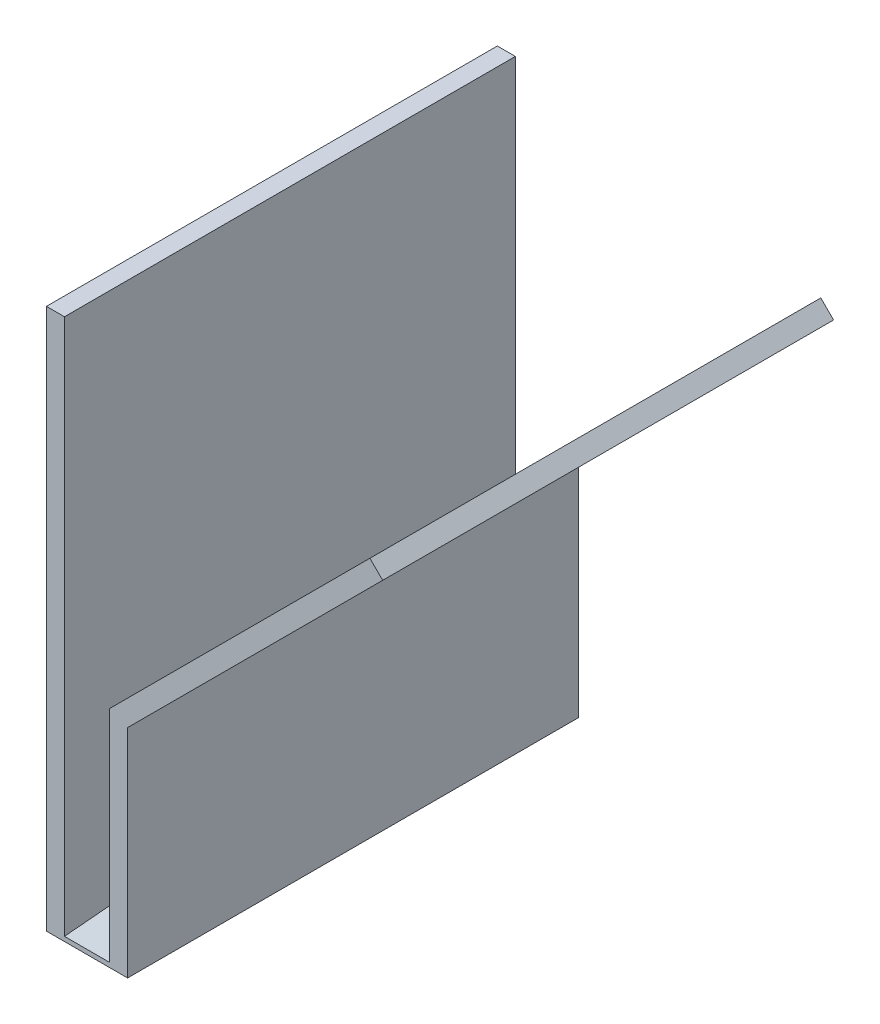
from build123d import *

# Parameters (mm, degrees)
SKETCH1_W           = 4
SKETCH1_H           = 120
BOSS_EXTRUDE1_DEPTH = 100
BOSS_EXTRUDE2_DEPTH = 10
BOSS_EXTRUDE3_DEPTH = 100


with BuildPart() as part:
    # Sketch1 → Boss-Extrude1 (new body)
    with BuildSketch(Plane.XY):
        with Locations((2, 60)):
            Rectangle(SKETCH1_W, SKETCH1_H)
    extrude(amount=BOSS_EXTRUDE1_DEPTH)

    # Sketch2 → Boss-Extrude2 (add)
    with BuildSketch(Plane(origin=(4, 0, 0), x_dir=(0, 0, -1), z_dir=(1, 0, 0))):
        Polygon((-100, 0), (-100, 1), (0, 9.748866353), (0, 0), align=None)
    extrude(amount=BOSS_EXTRUDE2_DEPTH)

    # Sketch4 → Boss-Extrude3 (add)
    with BuildSketch(Plane(origin=(0, 0, 0), x_dir=(-1, 0, 0), z_dir=(0, 0, -1))):
        Polygon((-14, 0), (-14, 49.748866353), (-71.74011537, 107.488981723), (-74.568542495, 104.660554598), (-18, 48.092012103), (-18, 0), align=None)
    extrude(amount=-BOSS_EXTRUDE3_DEPTH)


solid = part.part
